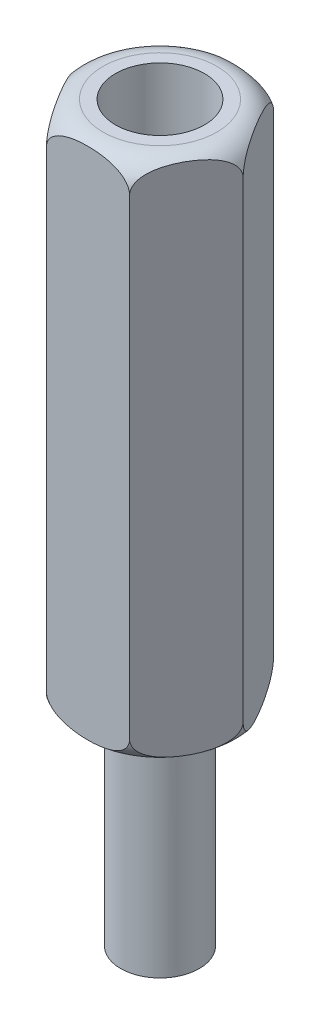
from build123d import *

# Parameters (mm, degrees)
BOSS_EXTRUDE1_DEPTH      = 20
M3_CLEARANCE_HOLE1_D     = 3.4
M3_CLEARANCE_HOLE1_DEPTH = 12
M3_CLEARANCE_HOLE1_TIP   = 1.021463052
SKETCH5_R                = 1.5
BOSS_EXTRUDE2_DEPTH      = 8


with BuildPart() as part:
    # Sketch1 → Boss-Extrude1 (new body)
    with BuildSketch(Plane(origin=(0, 0, 0), x_dir=(1, 0, 0), z_dir=(0, 1, 0))):
        Polygon((3.175426481, 0), (1.58771324, 2.75), (-1.58771324, 2.75), (-3.175426481, 0), (-1.58771324, -2.75), (1.58771324, -2.75), align=None)
    extrude(amount=BOSS_EXTRUDE1_DEPTH)

    # M3 Clearance Hole1
    with Locations(Plane(origin=(0, 20, 0), x_dir=(-1, 0, 0), z_dir=(0, 1, 0))):
        with Locations((0, 0)):
            Hole(M3_CLEARANCE_HOLE1_D / 2, depth=M3_CLEARANCE_HOLE1_DEPTH)
            with Locations((0, 0, -(M3_CLEARANCE_HOLE1_DEPTH + M3_CLEARANCE_HOLE1_TIP / 2))):  # 118° drill point
                Cone(0, M3_CLEARANCE_HOLE1_D / 2, M3_CLEARANCE_HOLE1_TIP, mode=Mode.SUBTRACT)

    # Sketch4 → Cut-Revolve1 (revolve, cut)
    with BuildSketch(Plane.XY, mode=Mode.PRIVATE) as cut_revolve1_sk:
        with BuildLine():
            Line((-2.175426481, 20), (-3.175426481, 20))
            Line((-3.175426481, 20), (-3.175426481, 19))
            ThreePointArc((-3.175426481, 19), (-2.882533262, 19.707106781), (-2.175426481, 20))
        make_face()
        with BuildLine():
            Line((-3.175426481, 1), (-3.175426481, 0))
            Line((-3.175426481, 0), (-2.175426481, 0))
            ThreePointArc((-2.175426481, 0), (-2.882533262, 0.292893219), (-3.175426481, 1))
        make_face()
    revolve(cut_revolve1_sk.sketch.rotate(Axis((0, 20, 0), (0, -1, 0)), 270), axis=Axis((0, 20, 0), (0, -1, 0)), mode=Mode.SUBTRACT)

    # Sketch5 → Boss-Extrude2 (add)
    with BuildSketch(Plane.XZ):
        with Locations(Location((0, 0, 0), (0, 0, 90))):
            Circle(SKETCH5_R)
    extrude(amount=BOSS_EXTRUDE2_DEPTH)


solid = part.part
